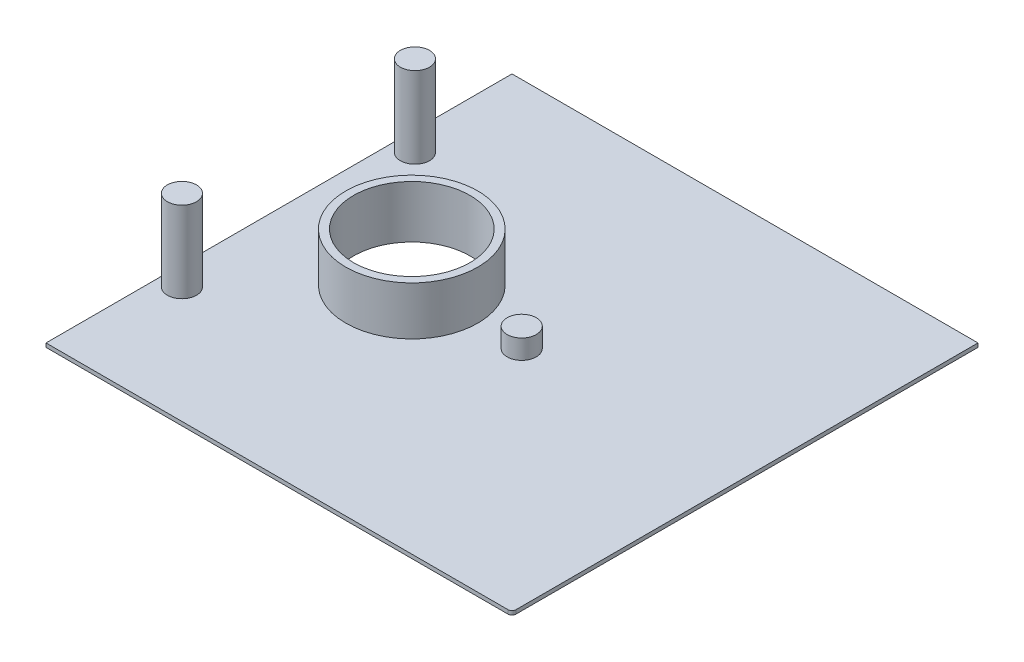
from build123d import *

# Parameters (mm, degrees)
SKETCH1_W           = 304.8
SKETCH1_H           = 304.8
BOSS_EXTRUDE1_DEPTH = 2.54
SKETCH3_R           = 9.525
BOSS_EXTRUDE2_DEPTH = 12.7
SKETCH5_R           = 38.1
CUT_EXTRUDE2_DEPTH  = 255.31730181
SKETCH7_R           = 9.525
BOSS_EXTRUDE4_DEPTH = 53.0225
FILLET1_R           = 2.54
BOSS_EXTRUDE5_START = 31.75
SKETCH9_R           = 43.18
SKETCH9_R_2         = 38.1
BOSS_EXTRUDE5_DEPTH = 31.75


with BuildPart() as part:
    # Sketch1 → Boss-Extrude1 (new body)
    with BuildSketch(Plane(origin=(0, 0, 0), x_dir=(1, 0, 0), z_dir=(0, 1, 0))):
        with Locations((50.8, 0)):
            Rectangle(SKETCH1_W, SKETCH1_H)
    extrude(amount=BOSS_EXTRUDE1_DEPTH)

    # Sketch3 → Boss-Extrude2 (add)
    with BuildSketch(Plane(origin=(0, 2.54, 0), x_dir=(1, 0, 0), z_dir=(0, 1, 0))):
        with Locations(Location((57.15, 0, 0), (0, 0, 270))):
            Circle(SKETCH3_R)
    extrude(amount=BOSS_EXTRUDE2_DEPTH)

    # Sketch5 → Cut-Extrude2 (cut, through all)
    with BuildSketch(Plane(origin=(0, 2.54, 0), x_dir=(1, 0, 0), z_dir=(0, 1, 0))):
        with Locations(Location((-14.741985059, 0, 0), (0, 0, 270))):
            Circle(SKETCH5_R)
    extrude(amount=-CUT_EXTRUDE2_DEPTH, mode=Mode.SUBTRACT)

    # Sketch7 → Boss-Extrude4 (add)
    with BuildSketch(Plane(origin=(0, 2.54, 0), x_dir=(1, 0, 0), z_dir=(0, 1, 0))):
        with Locations(Location((-88.9, 76.2, 0), (0, 0, 90))):
            Circle(SKETCH7_R)
    boss_extrude4 = extrude(amount=BOSS_EXTRUDE4_DEPTH)

    # Mirror1: Boss-Extrude4 across plane
    add(boss_extrude4.mirror(Plane.XY))

    # Fillet1
    fillet1_edges = [part.edges().sort_by_distance(p)[0] for p in [
        (203.2, 1.27, 152.4),
    ]]
    fillet(fillet1_edges, radius=FILLET1_R)

    # Sketch9 → Boss-Extrude5 (add)
    with BuildSketch(Plane(origin=(0, 2.54, 0), x_dir=(1, 0, 0), z_dir=(0, 1, 0)).offset(BOSS_EXTRUDE5_START)):
        with Locations(Location((-14.741985059, 0, 0), (0, 0, 270))):
            Circle(SKETCH9_R)
        with Locations(Location((-14.741985059, 0, 0), (0, 0, 270))):
            Circle(SKETCH9_R_2, mode=Mode.SUBTRACT)
    extrude(amount=-BOSS_EXTRUDE5_DEPTH)


solid = part.part
